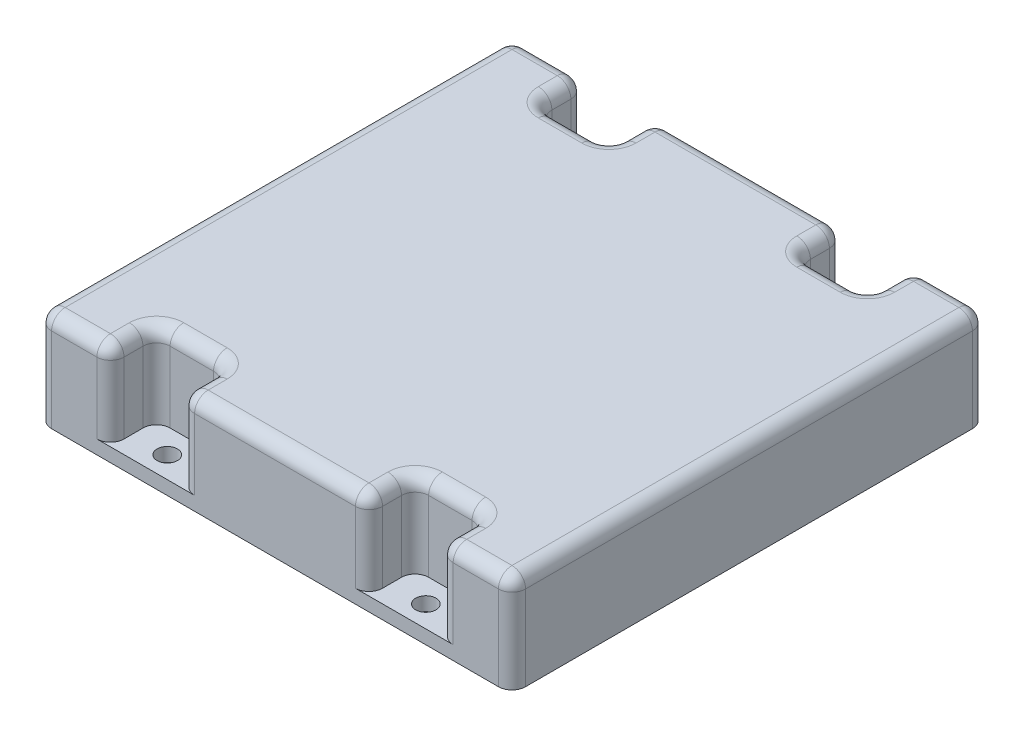
from build123d import *

# Parameters (mm, degrees)
SKETCH1_W                    = 139.7
SKETCH1_H                    = 139.7
BOSS_EXTRUDE1_DEPTH          = 4.064
BOSS_EXTRUDE2_DEPTH          = 24.892
FILLET1_R                    = 4
FILLET2_R                    = 4
F_6_0_6_DIAMETER_HOLE1_D     = 6
F_6_0_6_DIAMETER_HOLE1_DEPTH = 18.75
F_6_0_6_DIAMETER_HOLE1_TIP   = 1.802581857


with BuildPart() as part:
    # Sketch1 → Boss-Extrude1 (new body)
    with BuildSketch(Plane(origin=(0, 0, 0), x_dir=(1, 0, 0), z_dir=(0, 1, 0))):
        Rectangle(SKETCH1_W, SKETCH1_H)
    extrude(amount=BOSS_EXTRUDE1_DEPTH)

    # Sketch2 → Boss-Extrude2 (add)
    with BuildSketch(Plane(origin=(0, 4.064, 0), x_dir=(1, 0, 0), z_dir=(0, 1, 0))):
        Polygon((27.6987, 69.85), (-27.6987, 69.85), (-27.6987, 56.261), (-48.5013, 56.261), (-48.5013, 69.85), (-69.85, 69.85), (-69.85, -69.85), (-48.5013, -69.85), (-48.5013, -56.261), (-27.6987, -56.261), (-27.6987, -69.85), (27.6987, -69.85), (27.6987, -56.261), (48.5013, -56.261), (48.5013, -69.85), (69.85, -69.85), (69.85, 69.85), (48.5013, 69.85), (48.5013, 56.261), (27.6987, 56.261), align=None)
    extrude(amount=BOSS_EXTRUDE2_DEPTH)

    # Fillet1
    fillet1_edges = [part.edges().sort_by_distance(p)[0] for p in [
        (48.5013, 16.51, 69.85),
        (48.5013, 16.51, -69.85),
        (48.5013, 16.51, -56.261),
        (27.6987, 16.51, -56.261),
        (27.6987, 16.51, -69.85),
        (-27.6987, 16.51, -69.85),
        (-27.6987, 16.51, -56.261),
        (-48.5013, 16.51, -56.261),
        (-48.5013, 16.51, -69.85),
        (-48.5013, 16.51, 69.85),
        (-48.5013, 16.51, 56.261),
        (-27.6987, 16.51, 56.261),
        (-27.6987, 16.51, 69.85),
        (27.6987, 16.51, 69.85),
        (27.6987, 16.51, 56.261),
        (48.5013, 16.51, 56.261),
        (69.85, 14.478, 69.85),
        (-69.85, 14.478, 69.85),
        (-69.85, 14.478, -69.85),
        (69.85, 14.478, -69.85),
    ]]
    fillet(fillet1_edges, radius=FILLET1_R)

    # Fillet2
    fillet2_edges = [part.edges().sort_by_distance(p)[0] for p in [
        (47.329727125, 28.956, -57.432572875),
        (28.870272875, 28.956, -57.432572875),
        (-28.870272875, 28.956, -57.432572875),
        (-47.329727125, 28.956, -57.432572875),
        (-47.329727125, 28.956, 57.432572875),
        (-28.870272875, 28.956, 57.432572875),
        (47.329727125, 28.956, 57.432572875),
        (28.870272875, 28.956, 57.432572875),
        (-59.17565, 28.956, -69.85),
        (0, 28.956, -69.85),
        (59.17565, 28.956, -69.85),
        (69.85, 28.956, 0),
        (59.17565, 28.956, 69.85),
        (48.5013, 28.956, -63.0555),
        (38.1, 28.956, -56.261),
        (27.6987, 28.956, -63.0555),
        (-27.6987, 28.956, -63.0555),
        (-38.1, 28.956, -56.261),
        (-48.5013, 28.956, -63.0555),
        (-69.85, 28.956, 0),
        (-59.17565, 28.956, 69.85),
        (-48.5013, 28.956, 63.0555),
        (-38.1, 28.956, 56.261),
        (-27.6987, 28.956, 63.0555),
        (0, 28.956, 69.85),
        (27.6987, 28.956, 63.0555),
        (38.1, 28.956, 56.261),
        (48.5013, 28.956, 63.0555),
        (68.678427125, 28.956, 68.678427125),
        (26.527127125, 28.956, 68.678427125),
        (49.672872875, 28.956, 68.678427125),
        (-26.527127125, 28.956, 68.678427125),
        (-49.672872875, 28.956, 68.678427125),
        (-68.678427125, 28.956, 68.678427125),
        (-68.678427125, 28.956, -68.678427125),
        (-49.672872875, 28.956, -68.678427125),
        (-26.527127125, 28.956, -68.678427125),
        (26.527127125, 28.956, -68.678427125),
        (49.672872875, 28.956, -68.678427125),
        (68.678427125, 28.956, -68.678427125),
    ]]
    fillet(fillet2_edges, radius=FILLET2_R)

    # Ø6.0 (6) Diameter Hole1
    with Locations(Plane(origin=(0, 4.064, 0), x_dir=(1, 0, 0), z_dir=(0, 1, 0))):
        with Locations((-38.1, 63.5), (38.1, 63.5), (38.1, -63.5), (-38.1, -63.5)):
            Hole(F_6_0_6_DIAMETER_HOLE1_D / 2, depth=F_6_0_6_DIAMETER_HOLE1_DEPTH)
            with Locations((0, 0, -(F_6_0_6_DIAMETER_HOLE1_DEPTH + F_6_0_6_DIAMETER_HOLE1_TIP / 2))):  # 118° drill point
                Cone(0, F_6_0_6_DIAMETER_HOLE1_D / 2, F_6_0_6_DIAMETER_HOLE1_TIP, mode=Mode.SUBTRACT)


solid = part.part
